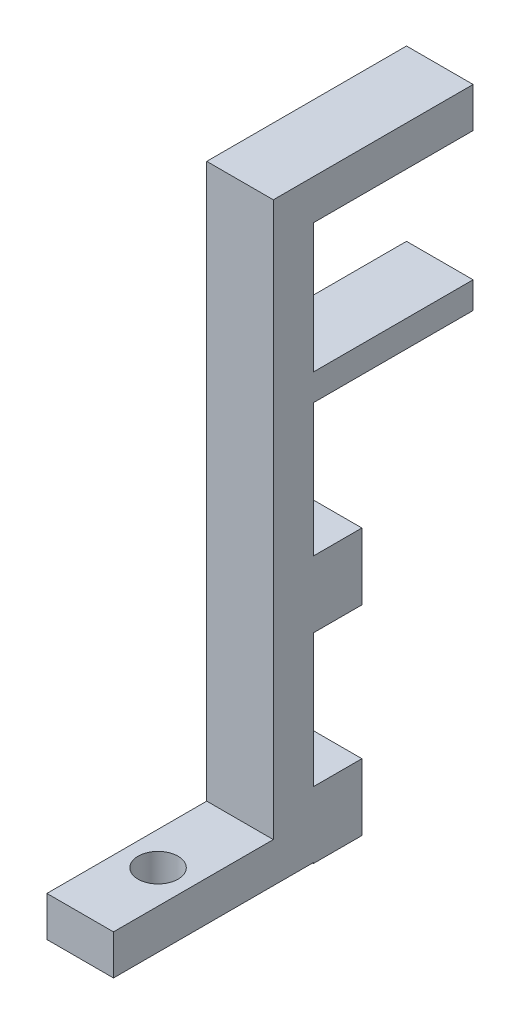
from build123d import *

# Parameters (mm, degrees)
SKETCH1_W           = 5
SKETCH1_H           = 38.6
BOSS_EXTRUDE1_DEPTH = 3
SKETCH3_W           = 5
SKETCH3_H           = 15
BOSS_EXTRUDE2_DEPTH = 3
SKETCH4_R           = 1.5
CUT_EXTRUDE1_DEPTH  = 4
SKETCH7_W           = 5
SKETCH7_H           = 15
BOSS_EXTRUDE3_DEPTH = 3
SKETCH8_W           = 5
SKETCH8_H           = 2
BOSS_EXTRUDE4_DEPTH = 12
SKETCH10_W          = 5
SKETCH10_H          = 5
BOSS_EXTRUDE5_DEPTH = 3.65


with BuildPart() as part:
    # Sketch1 → Boss-Extrude1 (new body)
    with BuildSketch(Plane.XY):
        Rectangle(SKETCH1_W, SKETCH1_H)
    extrude(amount=BOSS_EXTRUDE1_DEPTH)

    # Sketch3 → Boss-Extrude2 (add)
    with BuildSketch(Plane.XZ.offset(19.3)):
        with Locations((0, 7.5)):
            Rectangle(SKETCH3_W, SKETCH3_H)
    extrude(amount=BOSS_EXTRUDE2_DEPTH)

    # Sketch4 → Cut-Extrude1 (cut)
    with BuildSketch(Plane(origin=(0, -19.3, 0), x_dir=(1, 0, 0), z_dir=(0, 1, 0))):
        with Locations(Location((0, -9.153210304, 0), (0, 0, 270))):
            Circle(SKETCH4_R)
    extrude(amount=-CUT_EXTRUDE1_DEPTH, mode=Mode.SUBTRACT)

    # Sketch7 → Boss-Extrude3 (add)
    with BuildSketch(Plane(origin=(0, 19.3, 0), x_dir=(1, 0, 0), z_dir=(0, 1, 0))):
        with Locations((0, 4.5)):
            Rectangle(SKETCH7_W, SKETCH7_H)
    extrude(amount=BOSS_EXTRUDE3_DEPTH)

    # Sketch8 → Boss-Extrude4 (add)
    with BuildSketch(Plane(origin=(0, 0, 0), x_dir=(-1, 0, 0), z_dir=(0, 0, -1))):
        with Locations((0, 8.6)):
            Rectangle(SKETCH8_W, SKETCH8_H)
    extrude(amount=BOSS_EXTRUDE4_DEPTH)

    # Sketch10 → Boss-Extrude5 (add)
    with BuildSketch(Plane(origin=(0, 0, 0), x_dir=(-1, 0, 0), z_dir=(0, 0, -1))):
        with Locations((0, -4.864250557)):
            Rectangle(SKETCH10_W, SKETCH10_H)
        with Locations((0, -19.864250557)):
            Rectangle(SKETCH10_W, SKETCH10_H)
    extrude(amount=BOSS_EXTRUDE5_DEPTH)


solid = part.part
